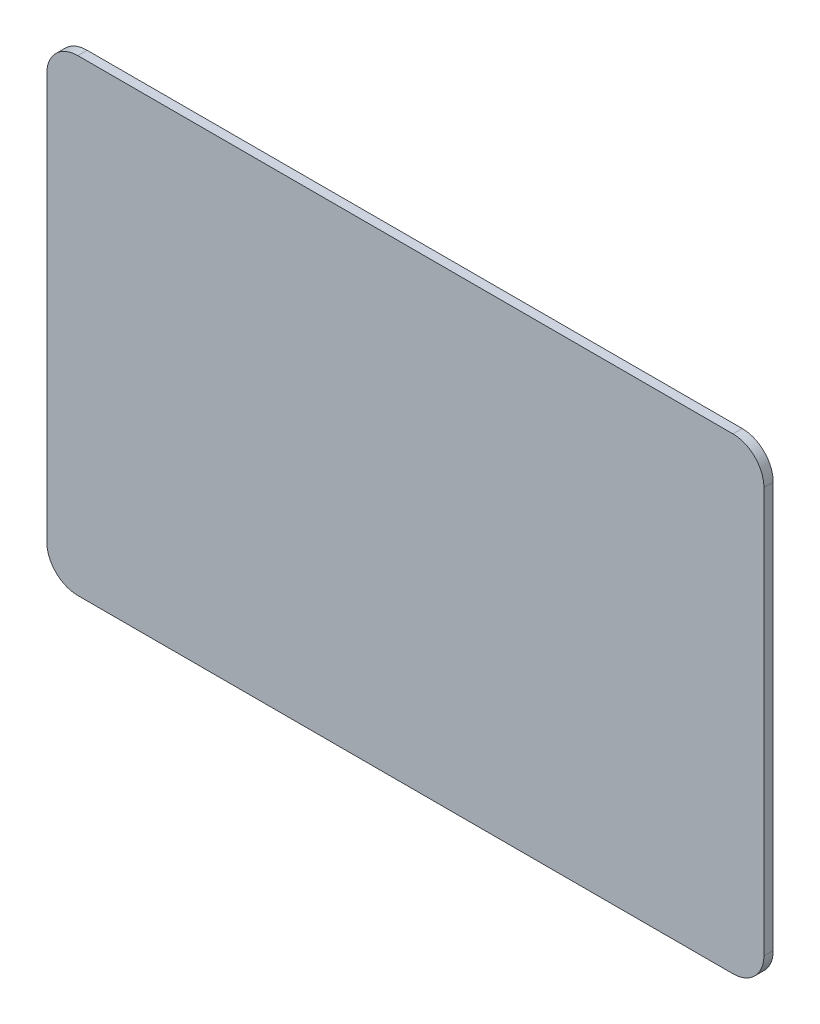
from build123d import *

# Parameters (mm, degrees)
BOSS_EXTRU_1_DEPTH = 1.5


with BuildPart() as part:
    # Esquisse1 → Boss.-Extru.1 (new body)
    with BuildSketch(Plane.XY):
        with BuildLine():
            Line((-52.88, 37.74), (52.88, 37.74))
            ThreePointArc((52.88, 37.74), (56.415533906, 36.275533906), (57.88, 32.74))
            Line((57.88, 32.74), (57.88, -32.74))
            ThreePointArc((57.88, -32.74), (56.415533906, -36.275533906), (52.88, -37.74))
            Line((52.88, -37.74), (-52.88, -37.74))
            ThreePointArc((-52.88, -37.74), (-56.415533906, -36.275533906), (-57.88, -32.74))
            Line((-57.88, -32.74), (-57.88, 32.74))
            ThreePointArc((-57.88, 32.74), (-56.415533906, 36.275533906), (-52.88, 37.74))
        make_face()
    extrude(amount=BOSS_EXTRU_1_DEPTH)


solid = part.part
